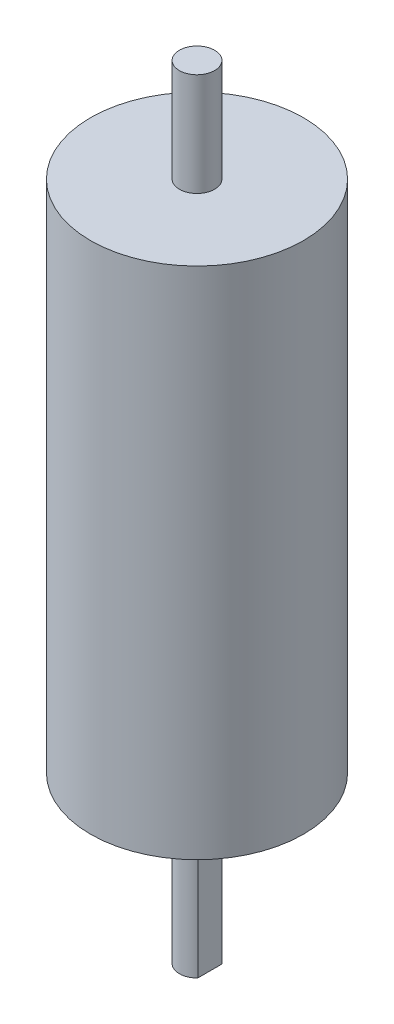
from build123d import *
from build123d.topology import SkipClean

# Parameters (mm, degrees)
CROQUIS1_R              = 14.5
SALIENTE_EXTRUIR1_DEPTH = 35
CROQUIS2_R              = 2.4
SALIENTE_EXTRUIR2_DEPTH = 43
SALIENTE_EXTRUIR3_DEPTH = 14.5
SALIENTE_EXTRUIR4_START = 6
CROQUIS4_R              = 2.4
SALIENTE_EXTRUIR4_DEPTH = 6


with BuildPart() as part:
    # Croquis1 → Saliente-Extruir1 (new, symmetric)
    with BuildSketch(Plane(origin=(0, 0, 0), x_dir=(1, 0, 0), z_dir=(0, 1, 0))):
        with Locations(Location((0, 0, 0), (0, 0, 270))):
            Circle(CROQUIS1_R)
    extrude(amount=SALIENTE_EXTRUIR1_DEPTH, both=True)

    # Croquis2 → Saliente-Extruir2 (add, symmetric)
    with BuildSketch(Plane(origin=(0, 0, 0), x_dir=(1, 0, 0), z_dir=(0, 1, 0))):
        with Locations(Location((0, 0, 0), (0, 0, 270))):
            Circle(CROQUIS2_R)
    extrude(amount=SALIENTE_EXTRUIR2_DEPTH, both=True)

    # Croquis3 → Saliente-Extruir3 (add)
    with SkipClean():  # the faces are left unmerged after this step: merging them gives an invalid solid
        with BuildSketch(Plane.XZ.offset(43)):
            with BuildLine():
                Line((-1.75, 1.642406771), (-1.75, -1.642406771))
                ThreePointArc((-1.75, -1.642406771), (0, -2.4), (1.75, -1.642406771))
                Line((1.75, -1.642406771), (1.75, 1.642406771))
                ThreePointArc((1.75, 1.642406771), (0, 2.4), (-1.75, 1.642406771))
            make_face()
        extrude(amount=SALIENTE_EXTRUIR3_DEPTH)

    # Croquis4 → Saliente-Extruir4 (add)
    with SkipClean():  # the faces are left unmerged after this step: merging them gives an invalid solid
        with BuildSketch(Plane(origin=(0, 43, 0), x_dir=(1, 0, 0), z_dir=(0, 1, 0)).offset(SALIENTE_EXTRUIR4_START)):
            with Locations(Location((0, 0, 0), (0, 0, 43.183421796))):
                Circle(CROQUIS4_R)
        extrude(amount=-SALIENTE_EXTRUIR4_DEPTH)


solid = part.part
